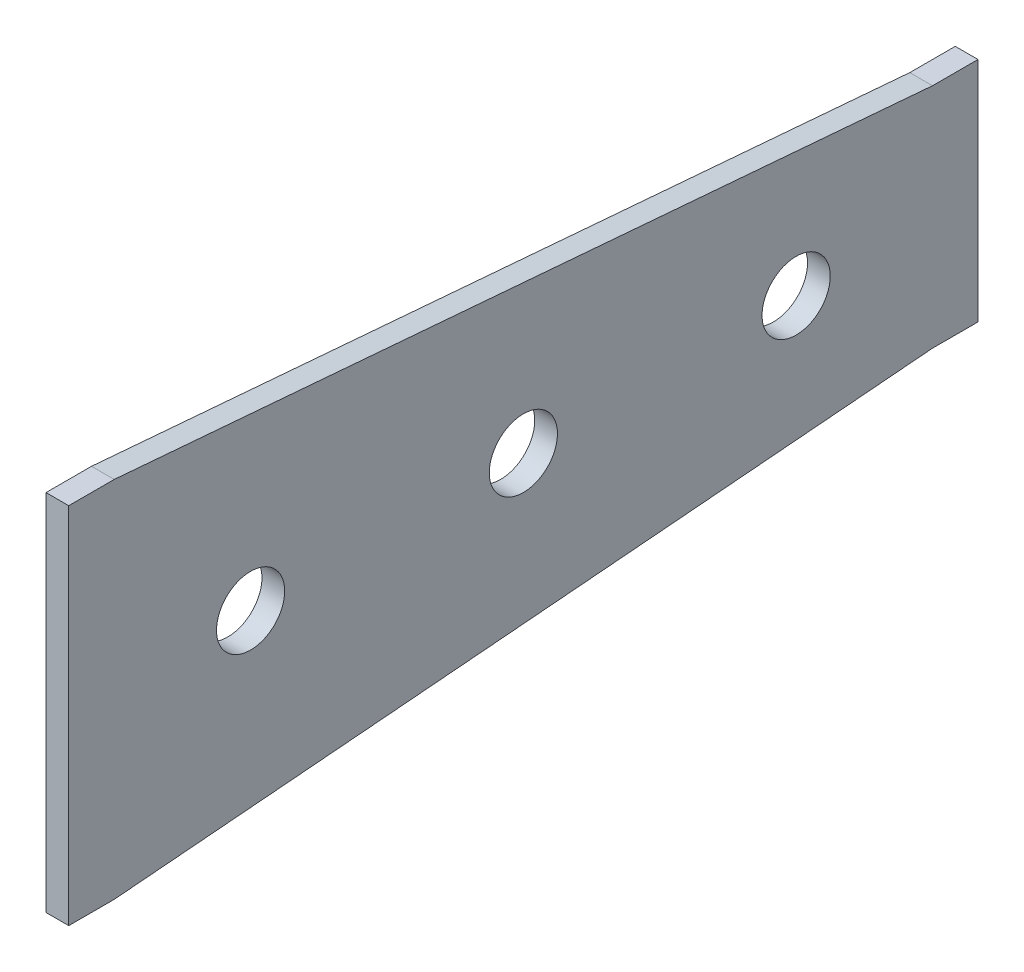
from build123d import *

# Parameters (mm, degrees)
SKETCH1_R           = 7.5
BOSS_EXTRUDE1_DEPTH = 2.5


with BuildPart() as part:
    # Sketch1 → Boss-Extrude1 (new, symmetric)
    with BuildSketch(Plane(origin=(0, 0, 0), x_dir=(0, 0, -1), z_dir=(1, 0, 0))):
        Polygon((100, -25), (100, 25), (90, 25), (-90, 40), (-100, 40), (-100, -40), (-90, -40), (90, -25), align=None)
        Circle(SKETCH1_R, mode=Mode.SUBTRACT)
        with Locations((-60, 0)):
            Circle(SKETCH1_R, mode=Mode.SUBTRACT)
        with Locations((60, 0)):
            Circle(SKETCH1_R, mode=Mode.SUBTRACT)
    extrude(amount=BOSS_EXTRUDE1_DEPTH, both=True)


solid = part.part
